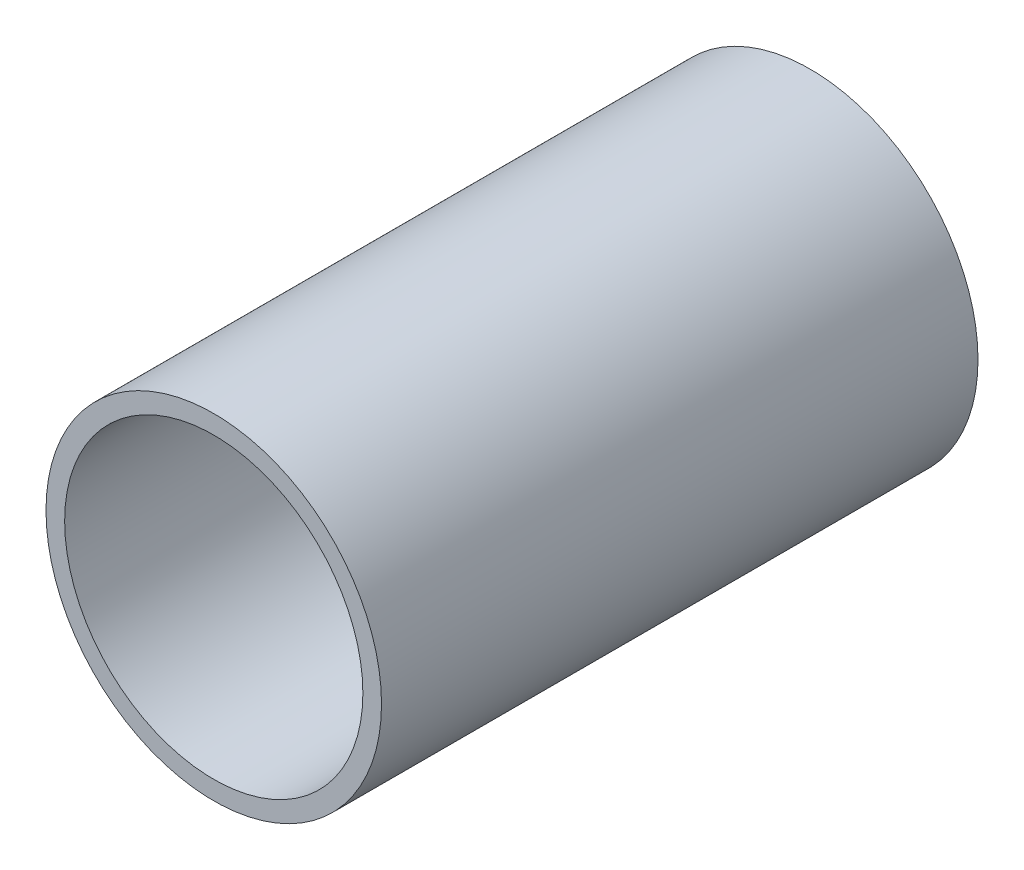
from build123d import *

# Parameters (mm, degrees)
SKETCH1_R           = 57.15
SKETCH1_R_2         = 50.8
BOSS_EXTRUDE1_DEPTH = 203.2


with BuildPart() as part:
    # Sketch1 → Boss-Extrude1 (new body)
    with BuildSketch(Plane.XY):
        Circle(SKETCH1_R)
        Circle(SKETCH1_R_2, mode=Mode.SUBTRACT)
    extrude(amount=BOSS_EXTRUDE1_DEPTH)


solid = part.part
